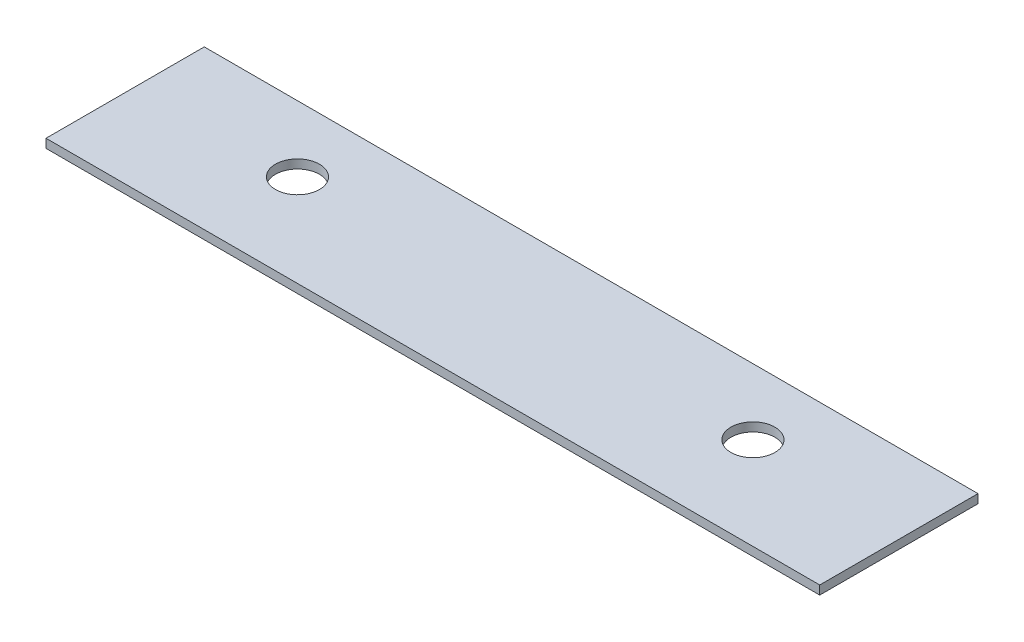
from build123d import *

# Parameters (mm, degrees)
SKETCH1_W           = 88
SKETCH1_H           = 18
BOSS_EXTRUDE1_DEPTH = 1
SKETCH2_R           = 2.5
CUT_EXTRUDE1_DEPTH  = 10


with BuildPart() as part:
    # Sketch1 → Boss-Extrude1 (new body)
    with BuildSketch(Plane(origin=(0, 0, 0), x_dir=(1, 0, 0), z_dir=(0, 1, 0))):
        with Locations((44.016421842, 7.300007491)):
            Rectangle(SKETCH1_W, SKETCH1_H)
    extrude(amount=BOSS_EXTRUDE1_DEPTH)

    # Sketch2 → Cut-Extrude1 (cut)
    with BuildSketch(Plane(origin=(0, 1, 0), x_dir=(1, 0, 0), z_dir=(0, 1, 0))):
        with Locations(Location((69.916421842, 8.800007491, 0), (0, 0, 270))):
            Circle(SKETCH2_R)
        with Locations(Location((18.116421842, 8.800007491, 0), (0, 0, 270))):
            Circle(SKETCH2_R)
    extrude(amount=-CUT_EXTRUDE1_DEPTH, mode=Mode.SUBTRACT)


solid = part.part
